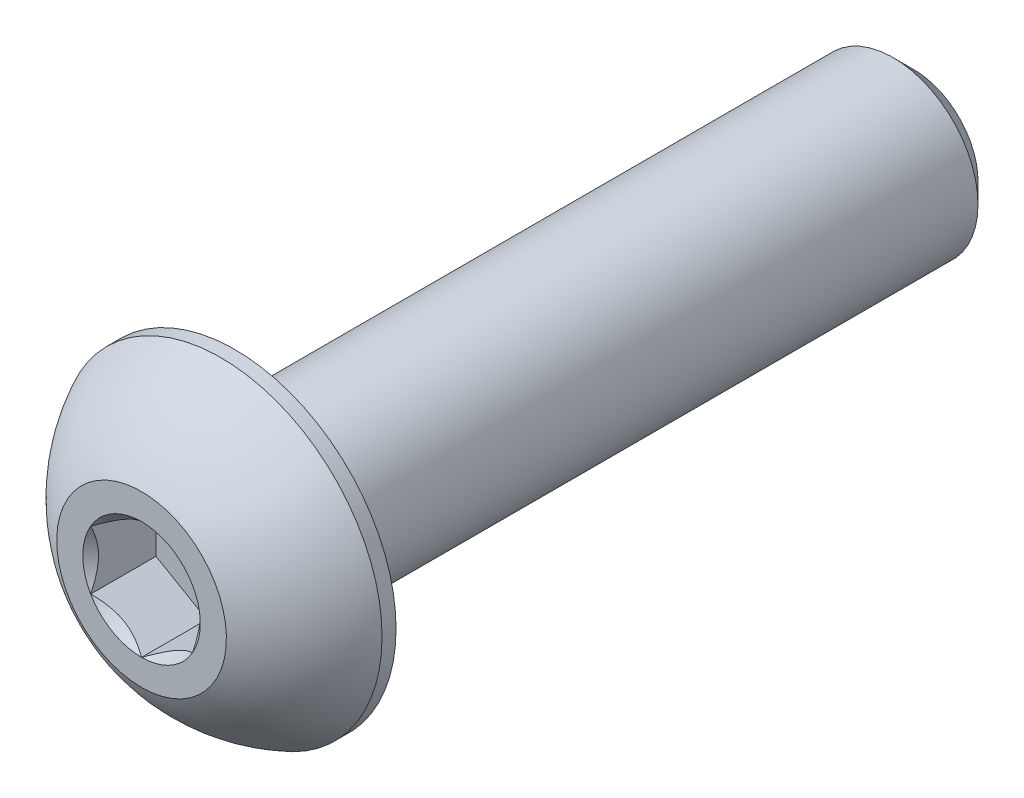
from build123d import *

# Parameters (mm, degrees)
CUT_EXTRUDE2_DEPTH = 1.925


with BuildPart() as part:
    # Sketch10 → Revolve3 (revolve)
    with BuildSketch(Plane(origin=(0, 0, 0), x_dir=(0, 0, -1), z_dir=(1, 0, 0)), mode=Mode.PRIVATE) as revolve3_sk:
        Polygon((22.15, 2.5), (22.75, 1.9), (22.75, 0), (2.75, 0), (2.75, 2.5), align=None)
    revolve(revolve3_sk.sketch.rotate(Axis((0, 0, 0), (0, 0, -1)), 90), axis=Axis((0, 0, 0), (0, 0, -1)))

    # Sketch7 → Revolve2 (revolve)
    with BuildSketch(Plane(origin=(0, 0, 0), x_dir=(0, 0, -1), z_dir=(1, 0, 0)), mode=Mode.PRIVATE) as revolve2_sk:
        with BuildLine():
            Line((2.3375, 4.75), (2.75, 4.75))
            Line((2.75, 4.75), (2.75, 0))
            Line((2.75, 0), (0, 0))
            Line((0, 0), (0, 2.5))
            ThreePointArc((0, 2.5), (0.991875183, 3.808753282), (2.3375, 4.75))
        make_face()
    revolve(revolve2_sk.sketch.rotate(Axis((0, 0, 0), (0, 0, -1)), 180), axis=Axis((0, 0, 0), (0, 0, -1)))

    # Sketch5 → Cut-Extrude2 (cut)
    with BuildSketch(Plane.XY):
        Polygon((1.5, -0.866025404), (1.5, 0.866025404), (0, 1.732050808), (-1.5, 0.866025404), (-1.5, -0.866025404), (0, -1.732050808), align=None)
    extrude(amount=-CUT_EXTRUDE2_DEPTH, mode=Mode.SUBTRACT)

    # Cut-Extrude3 cone 1 section (through the dimple's axis) → Cut-Extrude3 (revolve, cut)
    with BuildSketch(Plane(origin=(0, 0, 0), x_dir=(0, -1, 0), z_dir=(1, 0, 0))):
        Polygon((0, 0), (1.732050808, 0), (0, 1.732050808), align=None)
    revolve(axis=Axis((0, 0, 0), (0, 0, -1)), mode=Mode.SUBTRACT)


solid = part.part
